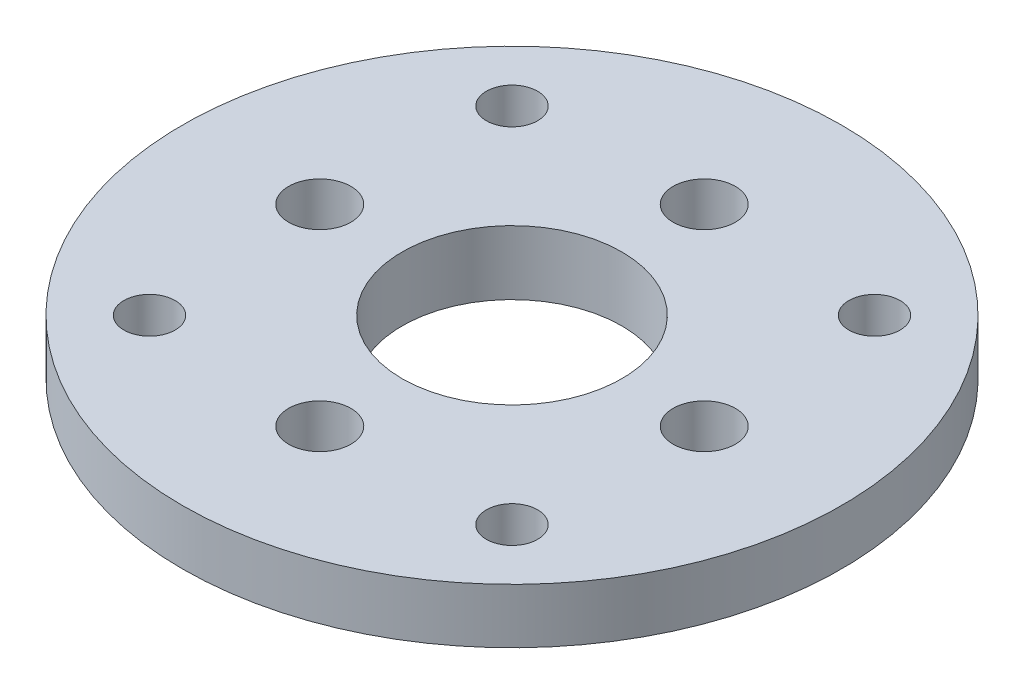
from build123d import *

# Parameters (mm, degrees)
SKETCH1_R           = 16.5
BOSS_EXTRUDE1_DEPTH = 0.5
SKETCH2_R           = 18
BOSS_EXTRUDE2_DEPTH = 3
SKETCH3_R           = 6
CUT_EXTRUDE1_DEPTH  = 26.695330315
SKETCH4_R           = 1.7
CUT_EXTRUDE2_DEPTH  = 26.695330315
CIRPATTERN1_COUNT   = 4
SKETCH5_R           = 1.4
CUT_EXTRUDE3_DEPTH  = 26.695330315
CIRPATTERN2_COUNT   = 4


with BuildPart() as part:
    # Sketch1 → Boss-Extrude1 (new body)
    with BuildSketch(Plane(origin=(0, 0, 0), x_dir=(1, 0, 0), z_dir=(0, 1, 0))):
        with Locations(Location((0, 0, 0), (0, 0, 270))):
            Circle(SKETCH1_R)
    extrude(amount=BOSS_EXTRUDE1_DEPTH)

    # Sketch2 → Boss-Extrude2 (add)
    with BuildSketch(Plane(origin=(0, 0.5, 0), x_dir=(1, 0, 0), z_dir=(0, 1, 0))):
        with Locations(Location((0, 0, 0), (0, 0, 270))):
            Circle(SKETCH2_R)
    extrude(amount=BOSS_EXTRUDE2_DEPTH)

    # Sketch3 → Cut-Extrude1 (cut, through all)
    with BuildSketch(Plane(origin=(0, 0, 0), x_dir=(1, 0, 0), z_dir=(0, 1, 0))):
        with Locations(Location((0, 0, 0), (0, 0, 270))):
            Circle(SKETCH3_R)
    extrude(amount=CUT_EXTRUDE1_DEPTH, mode=Mode.SUBTRACT)

    # Sketch4 → Cut-Extrude2 (cut, through all)
    with BuildSketch(Plane(origin=(0, 0, 0), x_dir=(1, 0, 0), z_dir=(0, 1, 0))):
        with Locations(Location((10.5, 0, 0), (0, 0, 270))):
            Circle(SKETCH4_R)
    cut_extrude2 = extrude(amount=CUT_EXTRUDE2_DEPTH, mode=Mode.SUBTRACT)

    # CirPattern1: Cut-Extrude2 ×4 about axis
    cirpattern1_axis = Axis((0, 0, 0), (0, 1, 0))
    for i in range(1, CIRPATTERN1_COUNT):
        add(cut_extrude2.rotate(cirpattern1_axis, i * 360 / CIRPATTERN1_COUNT), mode=Mode.SUBTRACT)

    # Sketch5 → Cut-Extrude3 (cut, through all)
    with BuildSketch(Plane(origin=(0, 0, 0), x_dir=(1, 0, 0), z_dir=(0, 1, 0))):
        with Locations(Location((9.899494937, 9.899494937, 0), (0, 0, 270))):
            Circle(SKETCH5_R)
    cut_extrude3 = extrude(amount=CUT_EXTRUDE3_DEPTH, mode=Mode.SUBTRACT)

    # CirPattern2: Cut-Extrude3 ×4 about axis
    cirpattern2_axis = Axis((0, 0, 0), (0, 1, 0))
    for i in range(1, CIRPATTERN2_COUNT):
        add(cut_extrude3.rotate(cirpattern2_axis, i * 360 / CIRPATTERN2_COUNT), mode=Mode.SUBTRACT)


solid = part.part
